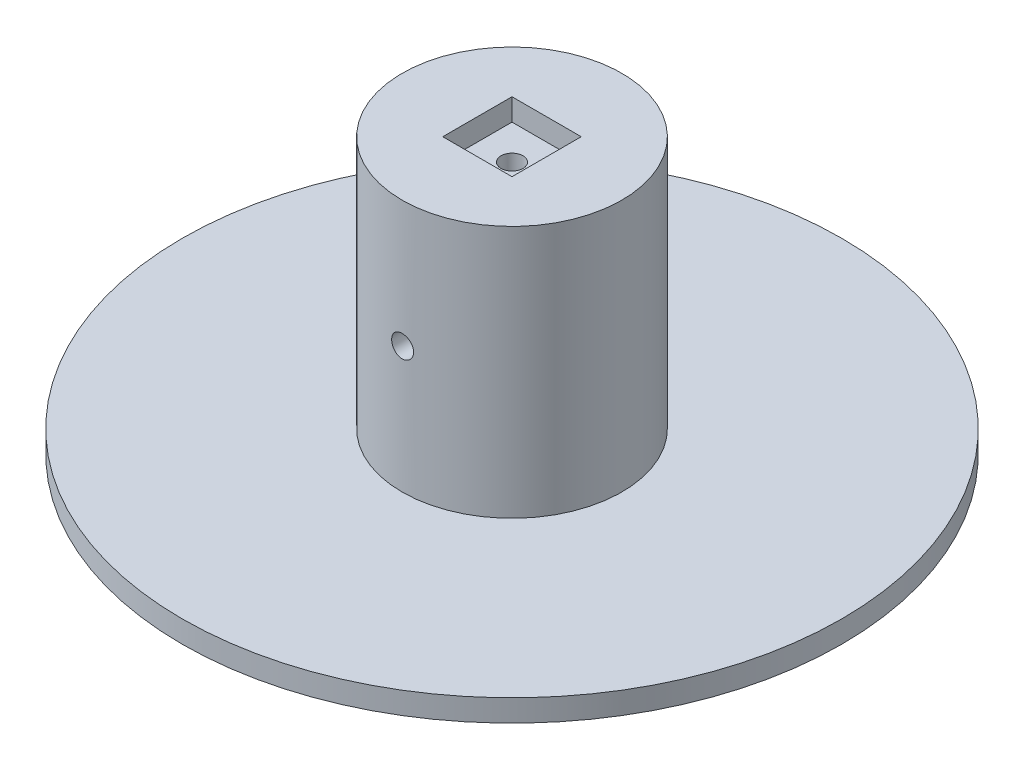
from build123d import *

# Parameters (mm, degrees)
SKETCH_1_R               = 30
EXTRUDE_1_DEPTH          = 2
SKETCH_1_8_R             = 10
EXTRUDE_2_DEPTH          = 25
SKETCH_3_W               = 6.3
SKETCH_3_H               = 6.3
CUT_EXTRUDE_3_DEPTH      = 2
CUT_EXTRUDE_START        = 25
SKETCH_1_9_R             = 1
CUT_EXTRUDE_1_DEPTH      = 4
CUT_EXTRUDE_2_DEPTH      = 50.244289009
CUT_EXTRUDE_2_DEPTH_BACK = 50.244289009
SKETCH_2_R               = 1


with BuildPart() as part:
    # 草图1 → 凸台-拉伸1 (new body)
    with BuildSketch(Plane(origin=(0, 0, 0), x_dir=(1, 0, 0), z_dir=(0, 1, 0))):
        with Locations(Location((0, 0, 0), (0, 0, 270))):
            Circle(SKETCH_1_R)
    extrude(amount=EXTRUDE_1_DEPTH)

    # 草图1<8> → 凸台-拉伸2 (add)
    with BuildSketch(Plane(origin=(0, 0, 0), x_dir=(1, 0, 0), z_dir=(0, 1, 0))):
        with Locations(Location((0, 0, 0), (0, 0, 270))):
            Circle(SKETCH_1_8_R)
    extrude(amount=EXTRUDE_2_DEPTH)

    # 草图3 → 切除-拉伸3 (cut)
    with BuildSketch(Plane(origin=(0, 25, 0), x_dir=(1, 0, 0), z_dir=(0, 1, 0))):
        Rectangle(SKETCH_3_W, SKETCH_3_H)
    extrude(amount=-CUT_EXTRUDE_3_DEPTH, mode=Mode.SUBTRACT)

    # 草图1<9> → 切除-拉伸1 (cut)
    with BuildSketch(Plane(origin=(0, 0, 0), x_dir=(1, 0, 0), z_dir=(0, 1, 0)).offset(CUT_EXTRUDE_START)):
        with Locations(Location((0, 0, 0), (0, 0, 270))):
            Circle(SKETCH_1_9_R)
    extrude(amount=-CUT_EXTRUDE_1_DEPTH, mode=Mode.SUBTRACT)

    # 草图2 → 切除-拉伸2 (cut, two sides: drawn at the far end of the back side and taken through both)
    with BuildSketch(Plane.XY.offset(-CUT_EXTRUDE_2_DEPTH_BACK)):
        with Locations((0, 13.5)):
            Circle(SKETCH_2_R)
    extrude(amount=CUT_EXTRUDE_2_DEPTH + CUT_EXTRUDE_2_DEPTH_BACK, mode=Mode.SUBTRACT)


solid = part.part
